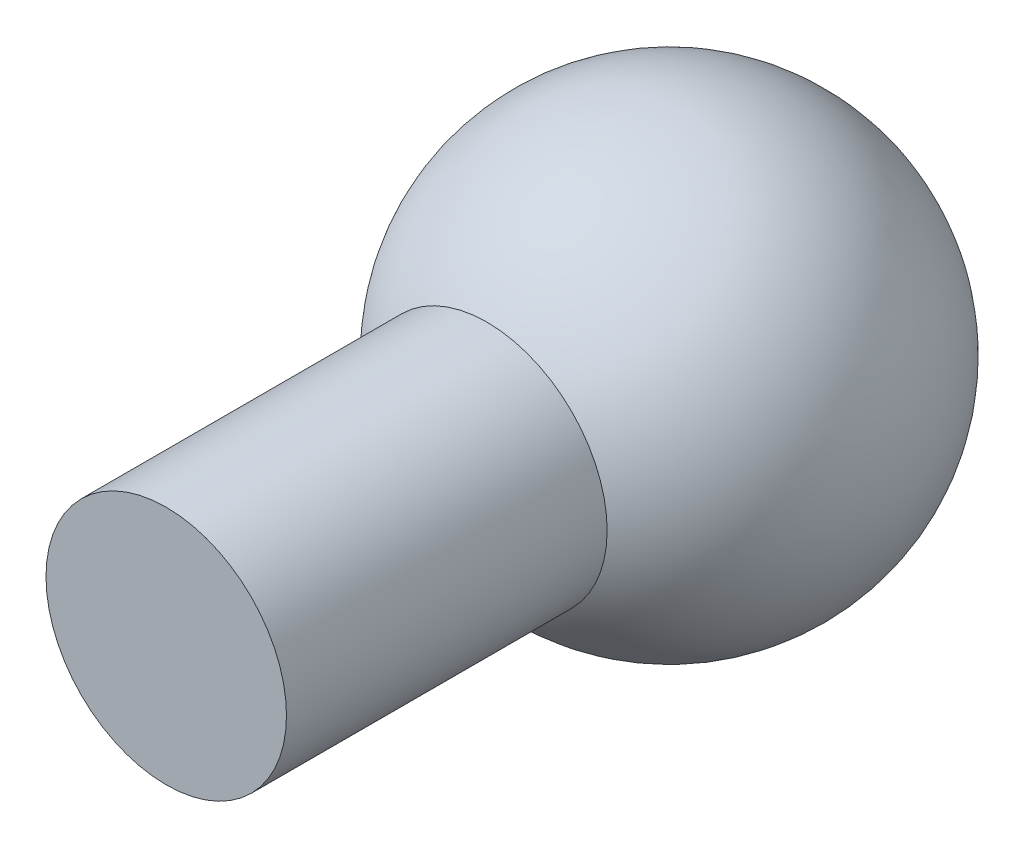
from build123d import *

# Parameters (mm, degrees)
SKETCH1_R           = 1.5
BOSS_EXTRUDE1_DEPTH = 4
DOME1_FACE_RADIUS   = 1.5
DOME1_HEIGHT        = 5


with BuildPart() as part:
    # Sketch1 → Boss-Extrude1 (new body)
    with BuildSketch(Plane.XY):
        Circle(SKETCH1_R)
    extrude(amount=BOSS_EXTRUDE1_DEPTH)

    # Dome1: a dome of height H over a round flat face of radius A is a cap of a sphere of radius (A * A + H * H) / (2 * H)
    dome1_r = (DOME1_FACE_RADIUS * DOME1_FACE_RADIUS + DOME1_HEIGHT * DOME1_HEIGHT) / (2 * DOME1_HEIGHT)
    dome1_base = Plane((0, 0, 0), z_dir=(0, 0, -1))
    with Locations(dome1_base.offset(DOME1_HEIGHT - dome1_r)):
        dome1_ball = Sphere(dome1_r, mode=Mode.PRIVATE)
    add(split(dome1_ball, bisect_by=dome1_base, keep=Keep.TOP, mode=Mode.PRIVATE))


solid = part.part
